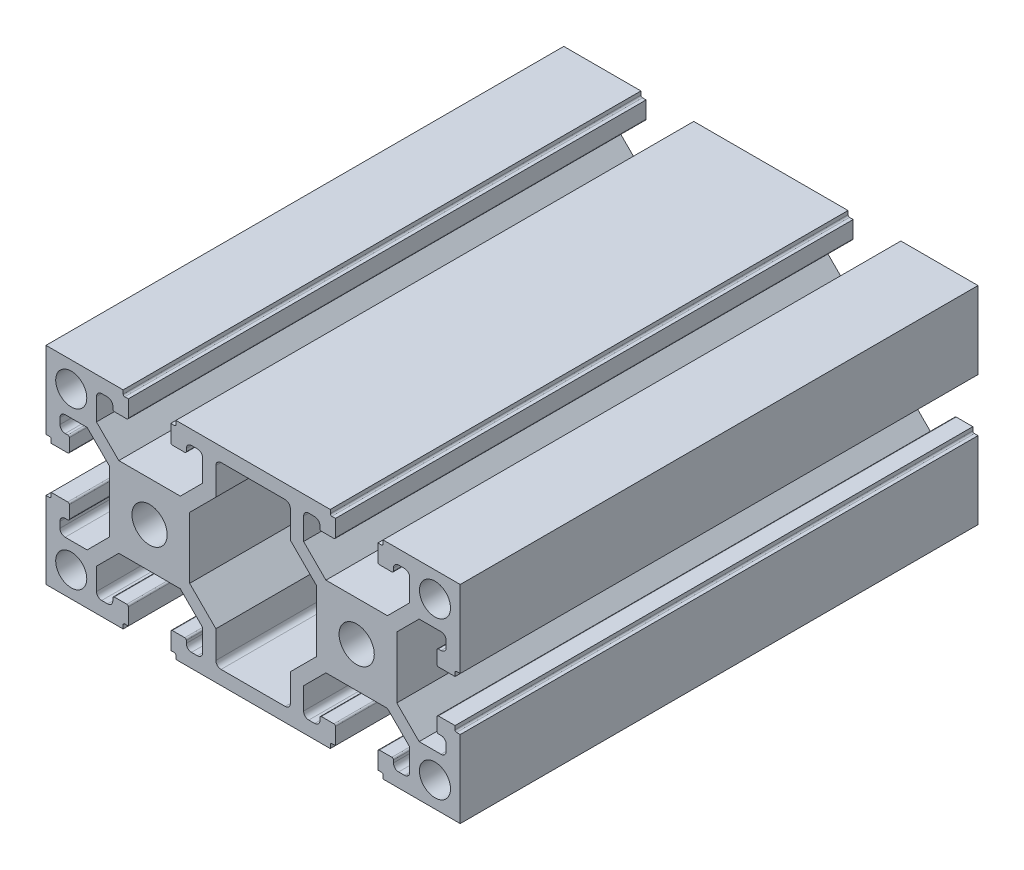
from build123d import *

# Parameters (mm, degrees)
SKETCH_1_R      = 3.4
SKETCH_1_R_2    = 3
EXTRUDE_1_DEPTH = 100


with BuildPart() as part:
    # 草图1 → 凸台-拉伸1 (new body)
    with BuildSketch(Plane.XY):
        with BuildLine():
            Line((-26.188418149, 19.242987377), (-41.088418149, 19.242987377))
            Line((-41.088418149, 19.242987377), (-41.088418149, 4.342987377))
            Line((-41.088418149, 4.342987377), (-40.388418149, 4.342987377))
            ThreePointArc((-40.388418149, 4.342987377), (-40.176286114, 4.255119412), (-40.088418149, 4.042987377))
            Line((-40.088418149, 4.042987377), (-40.088418149, 3.342987377))
            Line((-40.088418149, 3.342987377), (-36.888418149, 3.342987377))
            ThreePointArc((-36.888418149, 3.342987377), (-36.676286114, 3.430855343), (-36.588418149, 3.642987377))
            Line((-36.588418149, 3.642987377), (-36.588418149, 6.042987377))
            ThreePointArc((-36.588418149, 6.042987377), (-36.676286114, 6.255119412), (-36.888418149, 6.342987377))
            Line((-36.888418149, 6.342987377), (-37.388418149, 6.342987377))
            ThreePointArc((-37.388418149, 6.342987377), (-38.09552493, 6.635880596), (-38.388418149, 7.342987377))
            Line((-38.388418149, 7.342987377), (-38.388418149, 8.492987377))
            ThreePointArc((-38.388418149, 8.492987377), (-38.09552493, 9.200094158), (-37.388418149, 9.492987377))
            Line((-37.388418149, 9.492987377), (-33.148611509, 9.492987377))
            Line((-33.148611509, 9.492987377), (-28.838418149, 5.182794017))
            Line((-28.838418149, 5.182794017), (-28.838418149, -6.696819263))
            Line((-28.838418149, -6.696819263), (-33.148611509, -11.007012623))
            Line((-33.148611509, -11.007012623), (-37.388418149, -11.007012623))
            ThreePointArc((-37.388418149, -11.007012623), (-38.09552493, -10.714119404), (-38.388418149, -10.007012623))
            Line((-38.388418149, -10.007012623), (-38.388418149, -8.857012623))
            ThreePointArc((-38.388418149, -8.857012623), (-38.09552493, -8.149905842), (-37.388418149, -7.857012623))
            Line((-37.388418149, -7.857012623), (-36.888418149, -7.857012623))
            ThreePointArc((-36.888418149, -7.857012623), (-36.676286114, -7.769144657), (-36.588418149, -7.557012623))
            Line((-36.588418149, -7.557012623), (-36.588418149, -5.157012623))
            ThreePointArc((-36.588418149, -5.157012623), (-36.676286114, -4.944880588), (-36.888418149, -4.857012623))
            Line((-36.888418149, -4.857012623), (-40.088418149, -4.857012623))
            Line((-40.088418149, -4.857012623), (-40.088418149, -5.557012623))
            ThreePointArc((-40.088418149, -5.557012623), (-40.176286114, -5.769144657), (-40.388418149, -5.857012623))
            Line((-40.388418149, -5.857012623), (-41.088418149, -5.857012623))
            Line((-41.088418149, -5.857012623), (-41.088418149, -20.757012623))
            Line((-41.088418149, -20.757012623), (-26.188418149, -20.757012623))
            Line((-26.188418149, -20.757012623), (-26.188418149, -20.057012623))
            ThreePointArc((-26.188418149, -20.057012623), (-26.100550183, -19.844880588), (-25.888418149, -19.757012623))
            Line((-25.888418149, -19.757012623), (-25.188418149, -19.757012623))
            Line((-25.188418149, -19.757012623), (-25.188418149, -16.557012623))
            ThreePointArc((-25.188418149, -16.557012623), (-25.276286114, -16.344880588), (-25.488418149, -16.257012623))
            Line((-25.488418149, -16.257012623), (-27.888418149, -16.257012623))
            ThreePointArc((-27.888418149, -16.257012623), (-28.100550183, -16.344880588), (-28.188418149, -16.557012623))
            Line((-28.188418149, -16.557012623), (-28.188418149, -17.057012623))
            ThreePointArc((-28.188418149, -17.057012623), (-28.481311368, -17.764119404), (-29.188418149, -18.057012623))
            Line((-29.188418149, -18.057012623), (-30.338418149, -18.057012623))
            ThreePointArc((-30.338418149, -18.057012623), (-31.04552493, -17.764119404), (-31.338418149, -17.057012623))
            Line((-31.338418149, -17.057012623), (-31.338418149, -12.817205983))
            Line((-31.338418149, -12.817205983), (-27.028224789, -8.507012623))
            Line((-27.028224789, -8.507012623), (-15.148611509, -8.507012623))
            Line((-15.148611509, -8.507012623), (-10.838418149, -12.817205983))
            Line((-10.838418149, -12.817205983), (-10.838418149, -17.057012623))
            ThreePointArc((-10.838418149, -17.057012623), (-11.131311368, -17.764119404), (-11.838418149, -18.057012623))
            Line((-11.838418149, -18.057012623), (-12.988418149, -18.057012623))
            ThreePointArc((-12.988418149, -18.057012623), (-13.69552493, -17.764119404), (-13.988418149, -17.057012623))
            Line((-13.988418149, -17.057012623), (-13.988418149, -16.557012623))
            ThreePointArc((-13.988418149, -16.557012623), (-14.076286114, -16.344880588), (-14.288418149, -16.257012623))
            Line((-14.288418149, -16.257012623), (-16.688418149, -16.257012623))
            ThreePointArc((-16.688418149, -16.257012623), (-16.900550183, -16.344880588), (-16.988418149, -16.557012623))
            Line((-16.988418149, -16.557012623), (-16.988418149, -19.757012623))
            Line((-16.988418149, -19.757012623), (-16.288418149, -19.757012623))
            ThreePointArc((-16.288418149, -19.757012623), (-16.076286114, -19.844880588), (-15.988418149, -20.057012623))
            Line((-15.988418149, -20.057012623), (-15.988418149, -20.757012623))
            Line((-15.988418149, -20.757012623), (-1.088418149, -20.757012623))
            Line((-1.088418149, -20.757012623), (13.811581851, -20.757012623))
            Line((13.811581851, -20.757012623), (13.811581851, -20.057012623))
            ThreePointArc((13.811581851, -20.057012623), (13.899449817, -19.844880588), (14.111581851, -19.757012623))
            Line((14.111581851, -19.757012623), (14.811581851, -19.757012623))
            Line((14.811581851, -19.757012623), (14.811581851, -16.557012623))
            ThreePointArc((14.811581851, -16.557012623), (14.723713886, -16.344880588), (14.511581851, -16.257012623))
            Line((14.511581851, -16.257012623), (12.111581851, -16.257012623))
            ThreePointArc((12.111581851, -16.257012623), (11.899449817, -16.344880588), (11.811581851, -16.557012623))
            Line((11.811581851, -16.557012623), (11.811581851, -17.057012623))
            ThreePointArc((11.811581851, -17.057012623), (11.518688632, -17.764119404), (10.811581851, -18.057012623))
            Line((10.811581851, -18.057012623), (9.661581851, -18.057012623))
            ThreePointArc((9.661581851, -18.057012623), (8.95447507, -17.764119404), (8.661581851, -17.057012623))
            Line((8.661581851, -17.057012623), (8.661581851, -12.817205983))
            Line((8.661581851, -12.817205983), (12.971775211, -8.507012623))
            Line((12.971775211, -8.507012623), (24.851388491, -8.507012623))
            Line((24.851388491, -8.507012623), (29.161581851, -12.817205983))
            Line((29.161581851, -12.817205983), (29.161581851, -17.057012623))
            ThreePointArc((29.161581851, -17.057012623), (28.868688632, -17.764119404), (28.161581851, -18.057012623))
            Line((28.161581851, -18.057012623), (27.011581851, -18.057012623))
            ThreePointArc((27.011581851, -18.057012623), (26.30447507, -17.764119404), (26.011581851, -17.057012623))
            Line((26.011581851, -17.057012623), (26.011581851, -16.557012623))
            ThreePointArc((26.011581851, -16.557012623), (25.923713886, -16.344880588), (25.711581851, -16.257012623))
            Line((25.711581851, -16.257012623), (23.311581851, -16.257012623))
            ThreePointArc((23.311581851, -16.257012623), (23.099449817, -16.344880588), (23.011581851, -16.557012623))
            Line((23.011581851, -16.557012623), (23.011581851, -19.757012623))
            Line((23.011581851, -19.757012623), (23.711581851, -19.757012623))
            ThreePointArc((23.711581851, -19.757012623), (23.923713886, -19.844880588), (24.011581851, -20.057012623))
            Line((24.011581851, -20.057012623), (24.011581851, -20.757012623))
            Line((24.011581851, -20.757012623), (38.911581851, -20.757012623))
            Line((38.911581851, -20.757012623), (38.911581851, -5.857012623))
            Line((38.911581851, -5.857012623), (38.211581851, -5.857012623))
            ThreePointArc((38.211581851, -5.857012623), (37.999449817, -5.769144657), (37.911581851, -5.557012623))
            Line((37.911581851, -5.557012623), (37.911581851, -4.857012623))
            Line((37.911581851, -4.857012623), (34.711581851, -4.857012623))
            ThreePointArc((34.711581851, -4.857012623), (34.499449817, -4.944880588), (34.411581851, -5.157012623))
            Line((34.411581851, -5.157012623), (34.411581851, -7.557012623))
            ThreePointArc((34.411581851, -7.557012623), (34.499449817, -7.769144657), (34.711581851, -7.857012623))
            Line((34.711581851, -7.857012623), (35.211581851, -7.857012623))
            ThreePointArc((35.211581851, -7.857012623), (35.918688632, -8.149905842), (36.211581851, -8.857012623))
            Line((36.211581851, -8.857012623), (36.211581851, -10.007012623))
            ThreePointArc((36.211581851, -10.007012623), (35.918688632, -10.714119404), (35.211581851, -11.007012623))
            Line((35.211581851, -11.007012623), (30.971775211, -11.007012623))
            Line((30.971775211, -11.007012623), (26.661581851, -6.696819263))
            Line((26.661581851, -6.696819263), (26.661581851, 5.182794017))
            Line((26.661581851, 5.182794017), (30.971775211, 9.492987377))
            Line((30.971775211, 9.492987377), (35.211581851, 9.492987377))
            ThreePointArc((35.211581851, 9.492987377), (35.918688632, 9.200094158), (36.211581851, 8.492987377))
            Line((36.211581851, 8.492987377), (36.211581851, 7.342987377))
            ThreePointArc((36.211581851, 7.342987377), (35.918688632, 6.635880596), (35.211581851, 6.342987377))
            Line((35.211581851, 6.342987377), (34.711581851, 6.342987377))
            ThreePointArc((34.711581851, 6.342987377), (34.499449817, 6.255119412), (34.411581851, 6.042987377))
            Line((34.411581851, 6.042987377), (34.411581851, 3.642987377))
            ThreePointArc((34.411581851, 3.642987377), (34.499449817, 3.430855343), (34.711581851, 3.342987377))
            Line((34.711581851, 3.342987377), (37.911581851, 3.342987377))
            Line((37.911581851, 3.342987377), (37.911581851, 4.042987377))
            ThreePointArc((37.911581851, 4.042987377), (37.999449817, 4.255119412), (38.211581851, 4.342987377))
            Line((38.211581851, 4.342987377), (38.911581851, 4.342987377))
            Line((38.911581851, 4.342987377), (38.911581851, 19.242987377))
            Line((38.911581851, 19.242987377), (24.011581851, 19.242987377))
            Line((24.011581851, 19.242987377), (24.011581851, 18.542987377))
            ThreePointArc((24.011581851, 18.542987377), (23.923713886, 18.330855343), (23.711581851, 18.242987377))
            Line((23.711581851, 18.242987377), (23.011581851, 18.242987377))
            Line((23.011581851, 18.242987377), (23.011581851, 15.042987377))
            ThreePointArc((23.011581851, 15.042987377), (23.099449817, 14.830855343), (23.311581851, 14.742987377))
            Line((23.311581851, 14.742987377), (25.711581851, 14.742987377))
            ThreePointArc((25.711581851, 14.742987377), (25.923713886, 14.830855343), (26.011581851, 15.042987377))
            Line((26.011581851, 15.042987377), (26.011581851, 15.542987377))
            ThreePointArc((26.011581851, 15.542987377), (26.30447507, 16.250094158), (27.011581851, 16.542987377))
            Line((27.011581851, 16.542987377), (28.161581851, 16.542987377))
            ThreePointArc((28.161581851, 16.542987377), (28.868688632, 16.250094158), (29.161581851, 15.542987377))
            Line((29.161581851, 15.542987377), (29.161581851, 11.303180737))
            Line((29.161581851, 11.303180737), (24.851388491, 6.992987377))
            Line((24.851388491, 6.992987377), (12.971775211, 6.992987377))
            Line((12.971775211, 6.992987377), (8.661581851, 11.303180737))
            Line((8.661581851, 11.303180737), (8.661581851, 15.542987377))
            ThreePointArc((8.661581851, 15.542987377), (8.95447507, 16.250094158), (9.661581851, 16.542987377))
            Line((9.661581851, 16.542987377), (10.811581851, 16.542987377))
            ThreePointArc((10.811581851, 16.542987377), (11.518688632, 16.250094158), (11.811581851, 15.542987377))
            Line((11.811581851, 15.542987377), (11.811581851, 15.042987377))
            ThreePointArc((11.811581851, 15.042987377), (11.899449817, 14.830855343), (12.111581851, 14.742987377))
            Line((12.111581851, 14.742987377), (14.511581851, 14.742987377))
            ThreePointArc((14.511581851, 14.742987377), (14.723713886, 14.830855343), (14.811581851, 15.042987377))
            Line((14.811581851, 15.042987377), (14.811581851, 18.242987377))
            Line((14.811581851, 18.242987377), (14.111581851, 18.242987377))
            ThreePointArc((14.111581851, 18.242987377), (13.899449817, 18.330855343), (13.811581851, 18.542987377))
            Line((13.811581851, 18.542987377), (13.811581851, 19.242987377))
            Line((13.811581851, 19.242987377), (-1.088418149, 19.242987377))
            Line((-1.088418149, 19.242987377), (-15.988418149, 19.242987377))
            Line((-15.988418149, 19.242987377), (-15.988418149, 18.542987377))
            ThreePointArc((-15.988418149, 18.542987377), (-16.076286114, 18.330855343), (-16.288418149, 18.242987377))
            Line((-16.288418149, 18.242987377), (-16.988418149, 18.242987377))
            Line((-16.988418149, 18.242987377), (-16.988418149, 15.042987377))
            ThreePointArc((-16.988418149, 15.042987377), (-16.900550183, 14.830855343), (-16.688418149, 14.742987377))
            Line((-16.688418149, 14.742987377), (-14.288418149, 14.742987377))
            ThreePointArc((-14.288418149, 14.742987377), (-14.076286114, 14.830855343), (-13.988418149, 15.042987377))
            Line((-13.988418149, 15.042987377), (-13.988418149, 15.542987377))
            ThreePointArc((-13.988418149, 15.542987377), (-13.69552493, 16.250094158), (-12.988418149, 16.542987377))
            Line((-12.988418149, 16.542987377), (-11.838418149, 16.542987377))
            ThreePointArc((-11.838418149, 16.542987377), (-11.131311368, 16.250094158), (-10.838418149, 15.542987377))
            Line((-10.838418149, 15.542987377), (-10.838418149, 11.303180737))
            Line((-10.838418149, 11.303180737), (-15.148611509, 6.992987377))
            Line((-15.148611509, 6.992987377), (-27.028224789, 6.992987377))
            Line((-27.028224789, 6.992987377), (-31.338418149, 11.303180737))
            Line((-31.338418149, 11.303180737), (-31.338418149, 15.542987377))
            ThreePointArc((-31.338418149, 15.542987377), (-31.04552493, 16.250094158), (-30.338418149, 16.542987377))
            Line((-30.338418149, 16.542987377), (-29.188418149, 16.542987377))
            ThreePointArc((-29.188418149, 16.542987377), (-28.481311368, 16.250094158), (-28.188418149, 15.542987377))
            Line((-28.188418149, 15.542987377), (-28.188418149, 15.042987377))
            ThreePointArc((-28.188418149, 15.042987377), (-28.100550183, 14.830855343), (-27.888418149, 14.742987377))
            Line((-27.888418149, 14.742987377), (-25.488418149, 14.742987377))
            ThreePointArc((-25.488418149, 14.742987377), (-25.276286114, 14.830855343), (-25.188418149, 15.042987377))
            Line((-25.188418149, 15.042987377), (-25.188418149, 18.242987377))
            Line((-25.188418149, 18.242987377), (-25.888418149, 18.242987377))
            ThreePointArc((-25.888418149, 18.242987377), (-26.100550183, 18.330855343), (-26.188418149, 18.542987377))
            Line((-26.188418149, 18.542987377), (-26.188418149, 19.242987377))
        make_face()
        with Locations((-21.088418149, -0.757012623)):
            Circle(SKETCH_1_R, mode=Mode.SUBTRACT)
        with Locations((-36.213418149, 14.367987377)):
            Circle(SKETCH_1_R_2, mode=Mode.SUBTRACT)
        with Locations((-36.213418149, -15.882012623)):
            Circle(SKETCH_1_R_2, mode=Mode.SUBTRACT)
        with Locations((18.911581851, -0.757012623)):
            Circle(SKETCH_1_R, mode=Mode.SUBTRACT)
        with Locations((34.036581851, 14.367987377)):
            Circle(SKETCH_1_R_2, mode=Mode.SUBTRACT)
        with Locations((34.036581851, -15.882012623)):
            Circle(SKETCH_1_R_2, mode=Mode.SUBTRACT)
        with BuildLine():
            Line((-8.278418149, 10.242794017), (-8.278418149, 15.542987377))
            ThreePointArc((-8.278418149, 15.542987377), (-7.98552493, 16.250094158), (-7.278418149, 16.542987377))
            Line((-7.278418149, 16.542987377), (5.101581851, 16.542987377))
            ThreePointArc((5.101581851, 16.542987377), (5.808688632, 16.250094158), (6.101581851, 15.542987377))
            Line((6.101581851, 15.542987377), (6.101581851, 10.242794017))
            Line((6.101581851, 10.242794017), (11.161581851, 5.182794017))
            Line((11.161581851, 5.182794017), (11.161581851, -6.696819263))
            Line((11.161581851, -6.696819263), (6.101581851, -11.756819263))
            Line((6.101581851, -11.756819263), (6.101581851, -17.057012623))
            ThreePointArc((6.101581851, -17.057012623), (5.808688632, -17.764119404), (5.101581851, -18.057012623))
            Line((5.101581851, -18.057012623), (-7.278418149, -18.057012623))
            ThreePointArc((-7.278418149, -18.057012623), (-7.98552493, -17.764119404), (-8.278418149, -17.057012623))
            Line((-8.278418149, -17.057012623), (-8.278418149, -11.756819263))
            Line((-8.278418149, -11.756819263), (-13.338418149, -6.696819263))
            Line((-13.338418149, -6.696819263), (-13.338418149, 5.182794017))
            Line((-13.338418149, 5.182794017), (-8.278418149, 10.242794017))
        make_face(mode=Mode.SUBTRACT)
    extrude(amount=EXTRUDE_1_DEPTH)


solid = part.part
